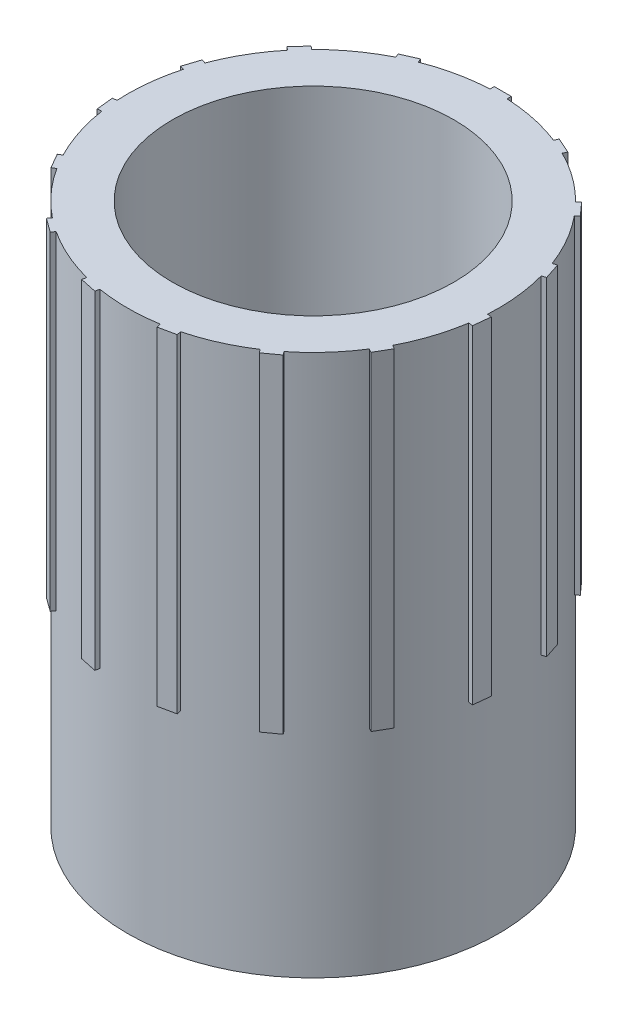
from build123d import *

# Parameters (mm, degrees)
SKETCH1_R            = 4.35
BODY_DEPTH           = 12.7
TEETH_START          = -7.7
TEETH_DEPTH          = 7.7
CIRPATTERN1_COUNT    = 15
M6_CLEARANCE_HOLE1_D = 6.6


with BuildPart() as part:
    # Sketch1 → Body (new body)
    with BuildSketch(Plane(origin=(0, 0, 0), x_dir=(1, 0, 0), z_dir=(0, 1, 0))):
        with Locations(Location((0, 0, 0), (0, 0, 270))):
            Circle(SKETCH1_R)
    extrude(amount=BODY_DEPTH)

    # Sketch2 → Teeth (add)
    with BuildSketch(Plane(origin=(0, 12.7, 0), x_dir=(1, 0, 0), z_dir=(0, 1, 0)).offset(TEETH_START)):
        with BuildLine():
            Line((-0.2, 4.345399867), (-0.2, 4.445399867))
            Line((-0.2, 4.445399867), (0.2, 4.445399867))
            Line((0.2, 4.445399867), (0.2, 4.345399867))
            ThreePointArc((0.2, 4.345399867), (0, 4.35), (-0.2, 4.345399867))
        make_face()
    teeth = extrude(amount=TEETH_DEPTH)

    # CirPattern1: Teeth ×15 about axis
    cirpattern1_axis = Axis((0, 0, 0), (0, 1, 0))
    for i in range(1, CIRPATTERN1_COUNT):
        add(teeth.rotate(cirpattern1_axis, i * 360 / CIRPATTERN1_COUNT))

    # M6 Clearance Hole1 (through all)
    with Locations(Plane(origin=(0, 12.7, 0), x_dir=(1, 0, 0), z_dir=(0, 1, 0))):
        with Locations((0, 0)):
            Hole(M6_CLEARANCE_HOLE1_D / 2)


solid = part.part
